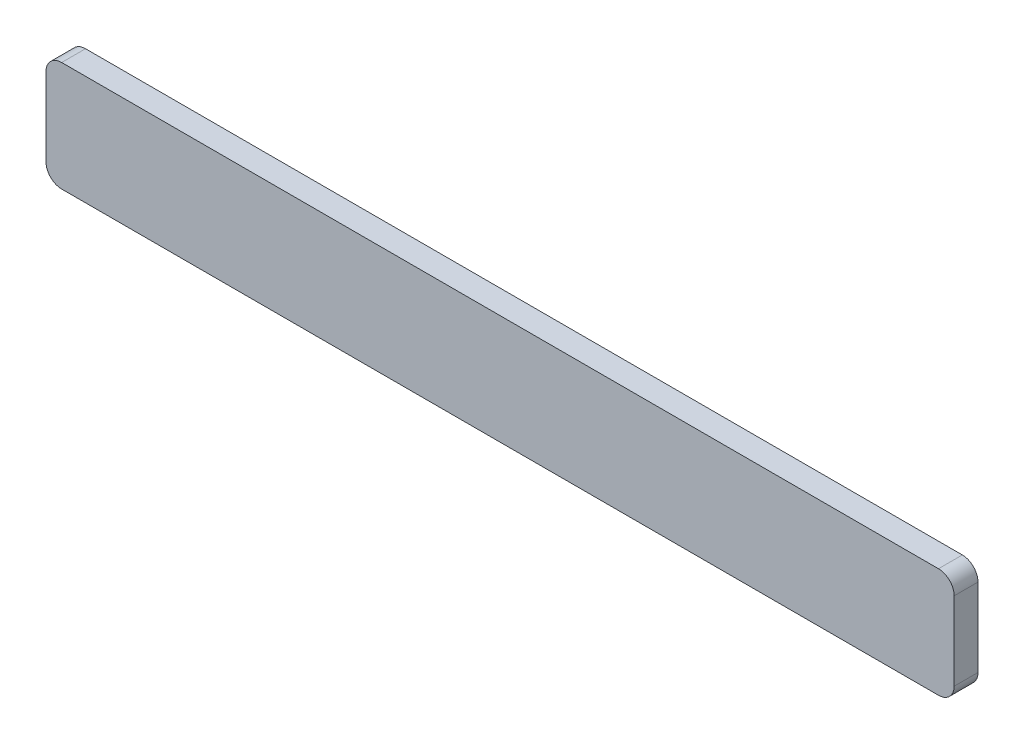
from build123d import *

# Parameters (mm, degrees)
SKETCH1_W           = 58
SKETCH1_H           = 7
BOSS_EXTRUDE1_DEPTH = 1.524
FILLET1_R           = 1


with BuildPart() as part:
    # Sketch1 → Boss-Extrude1 (new body)
    with BuildSketch(Plane.XY):
        Rectangle(SKETCH1_W, SKETCH1_H)
    extrude(amount=BOSS_EXTRUDE1_DEPTH)

    # Fillet1
    fillet1_edges = [part.edges().sort_by_distance(p)[0] for p in [
        (29, -3.5, 0.762),
        (-29, -3.5, 0.762),
        (-29, 3.5, 0.762),
        (29, 3.5, 0.762),
    ]]
    fillet(fillet1_edges, radius=FILLET1_R)


solid = part.part
